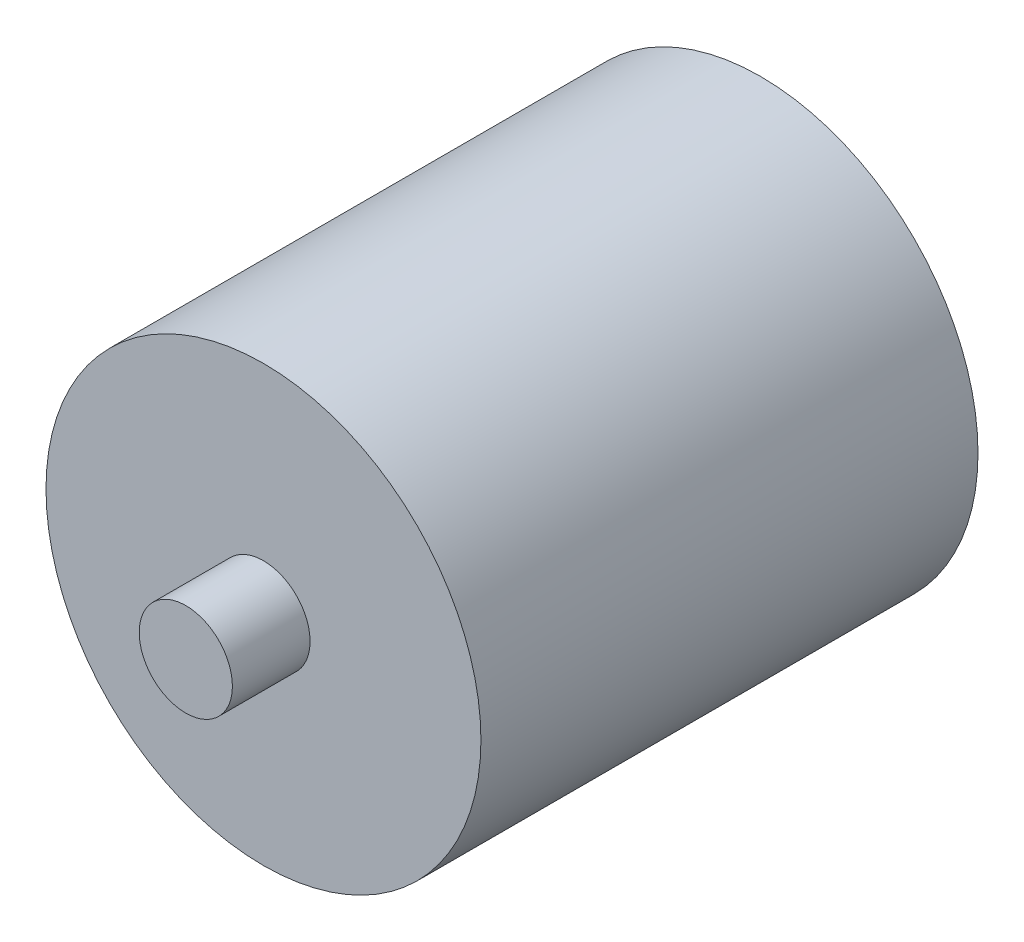
from build123d import *

# Parameters (mm, degrees)
SKETCH1_R           = 14
BOSS_EXTRUDE1_DEPTH = 32
SKETCH1_3_R         = 1.5
CUT_EXTRUDE1_DEPTH  = 5
SKETCH2_R           = 3
BOSS_EXTRUDE2_DEPTH = 5


with BuildPart() as part:
    # Sketch1 → Boss-Extrude1 (new body)
    with BuildSketch(Plane.XY):
        Circle(SKETCH1_R)
    extrude(amount=BOSS_EXTRUDE1_DEPTH)

    # Sketch1<3> → Cut-Extrude1 (cut)
    with BuildSketch(Plane.XY):
        with Locations((-9.5, 0)):
            Circle(SKETCH1_3_R)
        with Locations((0, 8)):
            Circle(SKETCH1_3_R)
        with Locations((0, -8)):
            Circle(SKETCH1_3_R)
        with Locations((9.5, 0)):
            Circle(SKETCH1_3_R)
    extrude(amount=CUT_EXTRUDE1_DEPTH, mode=Mode.SUBTRACT)

    # Sketch2 → Boss-Extrude2 (add)
    with BuildSketch(Plane.XY.offset(32)):
        Circle(SKETCH2_R)
    extrude(amount=BOSS_EXTRUDE2_DEPTH)


solid = part.part
